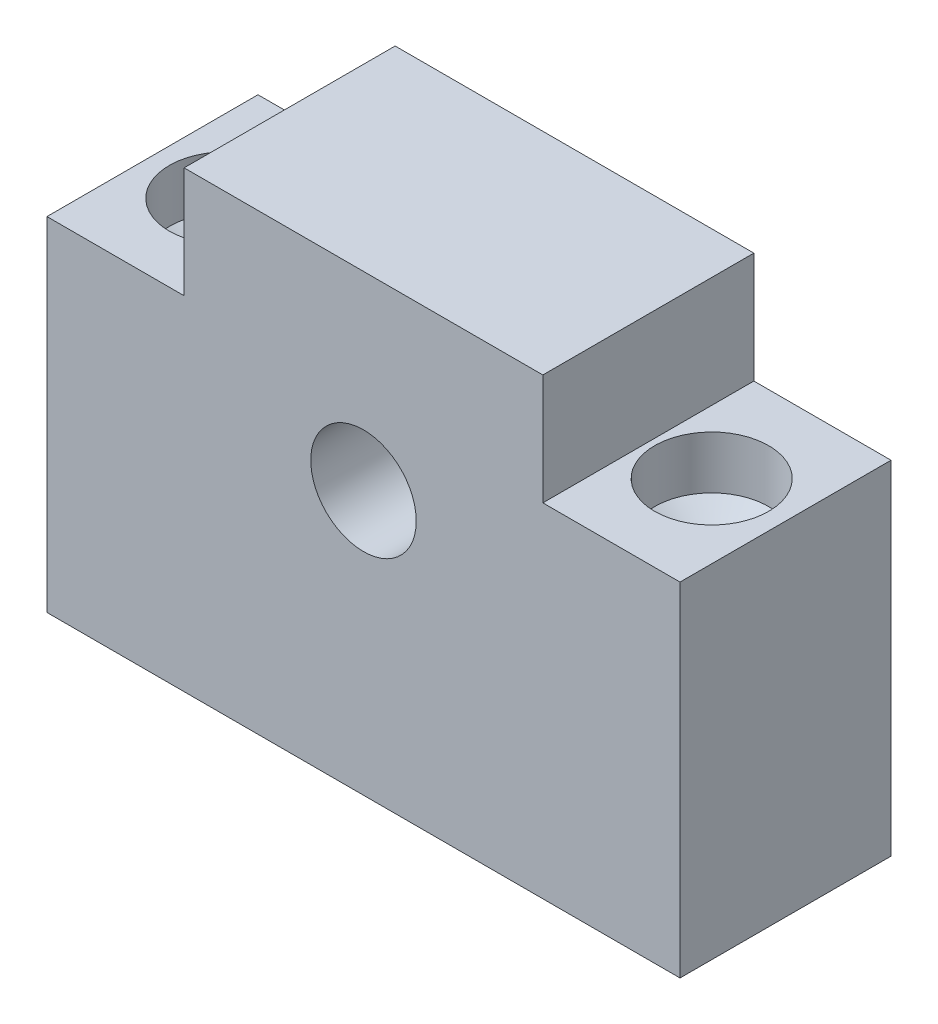
from build123d import *

# Parameters (mm, degrees)
BOSS_EXTRUDE1_DEPTH              = 20
SKETCH2_R                        = 5
CUT_EXTRUDE1_DEPTH               = 10
SKETCH3_R                        = 10
CUT_EXTRUDE2_DEPTH               = 10
F_10_8_10_8_DIAMETER_HOLE1_D     = 10.8
F_10_8_10_8_DIAMETER_HOLE1_DEPTH = 5
F_10_8_10_8_DIAMETER_HOLE1_TIP   = 3.244647343
F_6_6_6_6_DIAMETER_HOLE1_D       = 6.6


with BuildPart() as part:
    # Sketch1 → Boss-Extrude1 (new body)
    with BuildSketch(Plane.XY):
        Polygon((-17, 16.25), (-17, 26.75), (17, 26.75), (17, 16.25), (30, 16.25), (30, -16.25), (-30, -16.25), (-30, 16.25), align=None)
    extrude(amount=BOSS_EXTRUDE1_DEPTH)

    # Sketch2 → Cut-Extrude1 (cut)
    with BuildSketch(Plane.XY.offset(20)):
        with Locations((0, 8.75)):
            Circle(SKETCH2_R)
    extrude(amount=-CUT_EXTRUDE1_DEPTH, mode=Mode.SUBTRACT)

    # Sketch3 → Cut-Extrude2 (cut)
    with BuildSketch(Plane(origin=(0, 0, 0), x_dir=(-1, 0, 0), z_dir=(0, 0, -1))):
        with Locations((0, 8.75)):
            Circle(SKETCH3_R)
    extrude(amount=-CUT_EXTRUDE2_DEPTH, mode=Mode.SUBTRACT)

    # Ø10.8 (10.8) Diameter Hole1
    with Locations(Plane(origin=(0, 16.25, 0), x_dir=(1, 0, 0), z_dir=(0, 1, 0))):
        with Locations((-23, -10), (23, -10)):
            Hole(F_10_8_10_8_DIAMETER_HOLE1_D / 2, depth=F_10_8_10_8_DIAMETER_HOLE1_DEPTH)
            with Locations((0, 0, -(F_10_8_10_8_DIAMETER_HOLE1_DEPTH + F_10_8_10_8_DIAMETER_HOLE1_TIP / 2))):  # 118° drill point
                Cone(0, F_10_8_10_8_DIAMETER_HOLE1_D / 2, F_10_8_10_8_DIAMETER_HOLE1_TIP, mode=Mode.SUBTRACT)

    # Ø6.6 (6.6) Diameter Hole1 (through all)
    with Locations(Plane(origin=(0, 16.25, 0), x_dir=(1, 0, 0), z_dir=(0, 1, 0))):
        with Locations((-23, -10), (23, -10)):
            Hole(F_6_6_6_6_DIAMETER_HOLE1_D / 2)


solid = part.part
